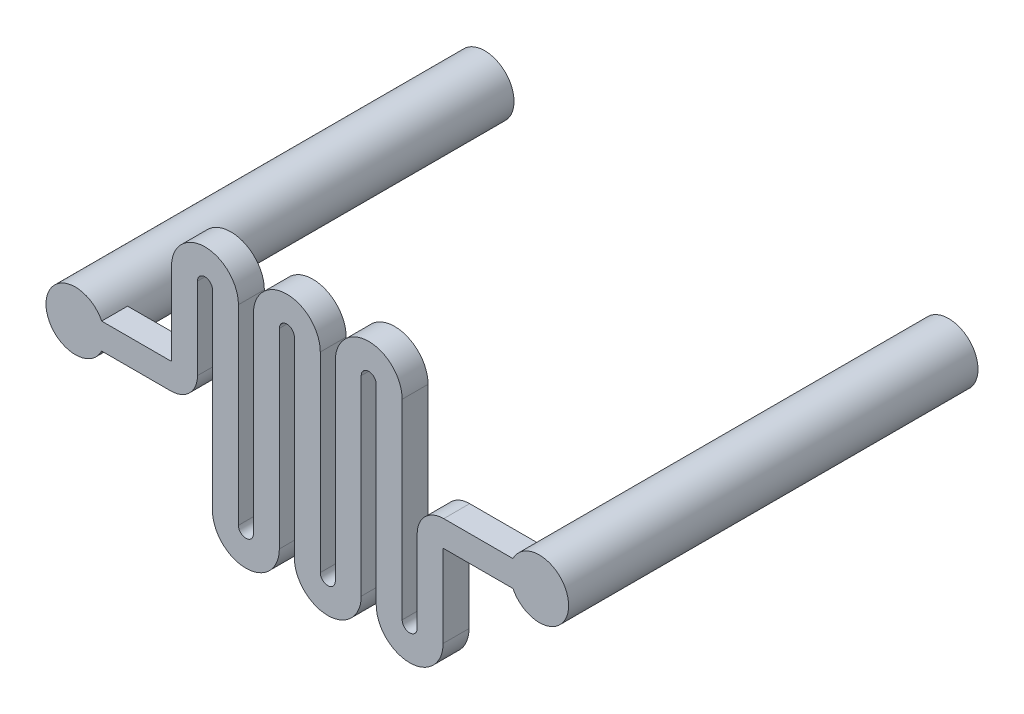
from build123d import *

# Parameters (mm, degrees)
BOSS_EXTRUDE1_DEPTH = 1.9
SKETCH5_W           = 2.15
SKETCH5_H           = 30
SKETCH4_W           = 2.15
SKETCH4_H           = 30
SKETCH6_R           = 1.5
CUT_EXTRUDE1_DEPTH  = 29


with BuildPart() as part:
    # Sketch2 → Boss-Extrude1 (new body)
    with BuildSketch(Plane.XY):
        with BuildLine():
            Line((-20.5, -0.95), (-13.5, -0.95))
            ThreePointArc((-13.5, -0.95), (-12.121141777, -0.378858223), (-11.55, 1))
            Line((-11.55, 1), (-11.55, 7))
            ThreePointArc((-11.55, 7), (-11, 7.55), (-10.45, 7))
            Line((-10.45, 7), (-10.45, 0))
            Line((-10.45, 0), (-10.45, -7))
            ThreePointArc((-10.45, -7), (-8, -9.45), (-5.55, -7))
            Line((-5.55, -7), (-5.55, 0))
            Line((-5.55, 0), (-5.55, 7))
            ThreePointArc((-5.55, 7), (-5, 7.55), (-4.45, 7))
            Line((-4.45, 7), (-4.45, 0))
            Line((-4.45, 0), (-4.45, -7))
            ThreePointArc((-4.45, -7), (-2, -9.45), (0.45, -7))
            Line((0.45, -7), (0.45, 0))
            Line((0.45, 0), (0.45, 7))
            ThreePointArc((0.45, 7), (1, 7.55), (1.55, 7))
            Line((1.55, 7), (1.55, 0))
            Line((1.55, 0), (1.55, -7))
            ThreePointArc((1.55, -7), (4, -9.45), (6.45, -7))
            Line((6.45, -7), (6.45, -1))
            ThreePointArc((6.45, -1), (6.464644661, -0.964644661), (6.5, -0.95))
            Line((6.5, -0.95), (13.5, -0.95))
            ThreePointArc((13.5, -0.95), (14.45, 0), (13.5, 0.95))
            Line((13.5, 0.95), (6.5, 0.95))
            ThreePointArc((6.5, 0.95), (5.121141777, 0.378858223), (4.55, -1))
            Line((4.55, -1), (4.55, -7))
            ThreePointArc((4.55, -7), (4, -7.55), (3.45, -7))
            Line((3.45, -7), (3.45, 0))
            Line((3.45, 0), (3.45, 7))
            ThreePointArc((3.45, 7), (1, 9.45), (-1.45, 7))
            Line((-1.45, 7), (-1.45, 0))
            Line((-1.45, 0), (-1.45, -7))
            ThreePointArc((-1.45, -7), (-2, -7.55), (-2.55, -7))
            Line((-2.55, -7), (-2.55, 0))
            Line((-2.55, 0), (-2.55, 7))
            ThreePointArc((-2.55, 7), (-5, 9.45), (-7.45, 7))
            Line((-7.45, 7), (-7.45, 0))
            Line((-7.45, 0), (-7.45, -7))
            ThreePointArc((-7.45, -7), (-8, -7.55), (-8.55, -7))
            Line((-8.55, -7), (-8.55, 0))
            Line((-8.55, 0), (-8.55, 7))
            ThreePointArc((-8.55, 7), (-11, 9.45), (-13.45, 7))
            Line((-13.45, 7), (-13.45, 1))
            ThreePointArc((-13.45, 1), (-13.464644661, 0.964644661), (-13.5, 0.95))
            Line((-13.5, 0.95), (-20.5, 0.95))
            ThreePointArc((-20.5, 0.95), (-21.45, 0), (-20.5, -0.95))
        make_face()
    extrude(amount=BOSS_EXTRUDE1_DEPTH)

    # Sketch5 → Revolve1 (revolve)
    with BuildSketch(Plane(origin=(0, 0, 0), x_dir=(1, 0, 0), z_dir=(0, 1, 0))):
        with Locations((-21.575, 13.1)):
            Rectangle(SKETCH5_W, SKETCH5_H)
    revolve(axis=Axis((-20.5, 0, -28.1), (0, 0, 1)))

    # Sketch4 → Revolve2 (revolve)
    with BuildSketch(Plane(origin=(0, 0, 0), x_dir=(1, 0, 0), z_dir=(0, 1, 0))):
        with Locations((14.575, 13.1)):
            Rectangle(SKETCH4_W, SKETCH4_H)
    revolve(axis=Axis((13.5, 0, 1.9), (0, 0, -1)))

    # Sketch6 → Cut-Extrude1 (cut)
    with BuildSketch(Plane(origin=(0, 0, -28.1), x_dir=(-1, 0, 0), z_dir=(0, 0, -1))):
        with Locations((-13.5, 0)):
            Circle(SKETCH6_R)
        with Locations((20.5, 0)):
            Circle(SKETCH6_R)
    extrude(amount=-CUT_EXTRUDE1_DEPTH, mode=Mode.SUBTRACT)


solid = part.part
